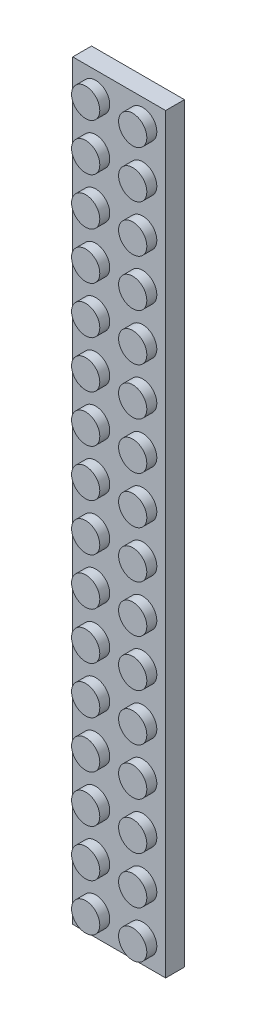
from build123d import *

# Parameters (mm, degrees)
SKETCH_1_W          = 15.8
SKETCH_1_H          = 127.8
EXTRUDE_1_DEPTH     = 3.2
SKETCH_2_R          = 2.4
EXTRUDE_2_DEPTH     = 1.7
SKETCH_3_R          = 2.5
CUT_EXTRUDE_1_DEPTH = 1.8


with BuildPart() as part:
    # Эскиз1 → Бобышка-Вытянуть1 (new body)
    with BuildSketch(Plane.XY):
        Rectangle(SKETCH_1_W, SKETCH_1_H)
    extrude(amount=EXTRUDE_1_DEPTH)

    # Эскиз2 → Бобышка-Вытянуть2 (add)
    with BuildSketch(Plane.XY.offset(3.2)):
        with Locations(Location((-4, 60, 0), (0, 0, 180))):
            Circle(SKETCH_2_R)
        with Locations(Location((4, 60, 0), (0, 0, 180))):
            Circle(SKETCH_2_R)
        with Locations(Location((4, 52, 0), (0, 0, 180))):
            Circle(SKETCH_2_R)
        with Locations(Location((4, 44, 0), (0, 0, 180))):
            Circle(SKETCH_2_R)
        with Locations(Location((4, 36, 0), (0, 0, 180))):
            Circle(SKETCH_2_R)
        with Locations(Location((4, 28, 0), (0, 0, 180))):
            Circle(SKETCH_2_R)
        with Locations(Location((4, 20, 0), (0, 0, 180))):
            Circle(SKETCH_2_R)
        with Locations(Location((4, 12, 0), (0, 0, 180))):
            Circle(SKETCH_2_R)
        with Locations(Location((4, 4, 0), (0, 0, 180))):
            Circle(SKETCH_2_R)
        with Locations(Location((4, -4, 0), (0, 0, 180))):
            Circle(SKETCH_2_R)
        with Locations(Location((4, -12, 0), (0, 0, 180))):
            Circle(SKETCH_2_R)
        with Locations(Location((4, -20, 0), (0, 0, 180))):
            Circle(SKETCH_2_R)
        with Locations(Location((4, -28, 0), (0, 0, 180))):
            Circle(SKETCH_2_R)
        with Locations(Location((4, -36, 0), (0, 0, 180))):
            Circle(SKETCH_2_R)
        with Locations(Location((4, -44, 0), (0, 0, 180))):
            Circle(SKETCH_2_R)
        with Locations(Location((4, -52, 0), (0, 0, 180))):
            Circle(SKETCH_2_R)
        with Locations(Location((4, -60, 0), (0, 0, 180))):
            Circle(SKETCH_2_R)
        with Locations(Location((-4, 52, 0), (0, 0, 180))):
            Circle(SKETCH_2_R)
        with Locations(Location((-4, 44, 0), (0, 0, 180))):
            Circle(SKETCH_2_R)
        with Locations(Location((-4, 36, 0), (0, 0, 180))):
            Circle(SKETCH_2_R)
        with Locations(Location((-4, 28, 0), (0, 0, 180))):
            Circle(SKETCH_2_R)
        with Locations(Location((-4, 20, 0), (0, 0, 180))):
            Circle(SKETCH_2_R)
        with Locations(Location((-4, 12, 0), (0, 0, 180))):
            Circle(SKETCH_2_R)
        with Locations(Location((-4, 4, 0), (0, 0, 180))):
            Circle(SKETCH_2_R)
        with Locations(Location((-4, -4, 0), (0, 0, 180))):
            Circle(SKETCH_2_R)
        with Locations(Location((-4, -12, 0), (0, 0, 180))):
            Circle(SKETCH_2_R)
        with Locations(Location((-4, -20, 0), (0, 0, 180))):
            Circle(SKETCH_2_R)
        with Locations(Location((-4, -28, 0), (0, 0, 180))):
            Circle(SKETCH_2_R)
        with Locations(Location((-4, -36, 0), (0, 0, 180))):
            Circle(SKETCH_2_R)
        with Locations(Location((-4, -44, 0), (0, 0, 180))):
            Circle(SKETCH_2_R)
        with Locations(Location((-4, -52, 0), (0, 0, 180))):
            Circle(SKETCH_2_R)
        with Locations(Location((-4, -60, 0), (0, 0, 180))):
            Circle(SKETCH_2_R)
    extrude(amount=EXTRUDE_2_DEPTH)

    # Эскиз3 → Вырез-Вытянуть1 (cut)
    with BuildSketch(Plane(origin=(0, 0, 0), x_dir=(-1, 0, 0), z_dir=(0, 0, -1))):
        with Locations((-4, 60)):
            Circle(SKETCH_3_R)
        with Locations((4, 60)):
            Circle(SKETCH_3_R)
        with Locations((4, 52)):
            Circle(SKETCH_3_R)
        with Locations((4, 44)):
            Circle(SKETCH_3_R)
        with Locations((4, 36)):
            Circle(SKETCH_3_R)
        with Locations((4, 28)):
            Circle(SKETCH_3_R)
        with Locations((4, 20)):
            Circle(SKETCH_3_R)
        with Locations((4, 12)):
            Circle(SKETCH_3_R)
        with Locations((4, 4)):
            Circle(SKETCH_3_R)
        with Locations((4, -4)):
            Circle(SKETCH_3_R)
        with Locations((4, -12)):
            Circle(SKETCH_3_R)
        with Locations((4, -20)):
            Circle(SKETCH_3_R)
        with Locations((4, -28)):
            Circle(SKETCH_3_R)
        with Locations((4, -36)):
            Circle(SKETCH_3_R)
        with Locations((4, -44)):
            Circle(SKETCH_3_R)
        with Locations((4, -52)):
            Circle(SKETCH_3_R)
        with Locations((4, -60)):
            Circle(SKETCH_3_R)
        with Locations((-4, 52)):
            Circle(SKETCH_3_R)
        with Locations((-4, 44)):
            Circle(SKETCH_3_R)
        with Locations((-4, 36)):
            Circle(SKETCH_3_R)
        with Locations((-4, 28)):
            Circle(SKETCH_3_R)
        with Locations((-4, 20)):
            Circle(SKETCH_3_R)
        with Locations((-4, 12)):
            Circle(SKETCH_3_R)
        with Locations((-4, 4)):
            Circle(SKETCH_3_R)
        with Locations((-4, -4)):
            Circle(SKETCH_3_R)
        with Locations((-4, -12)):
            Circle(SKETCH_3_R)
        with Locations((-4, -20)):
            Circle(SKETCH_3_R)
        with Locations((-4, -28)):
            Circle(SKETCH_3_R)
        with Locations((-4, -36)):
            Circle(SKETCH_3_R)
        with Locations((-4, -44)):
            Circle(SKETCH_3_R)
        with Locations((-4, -52)):
            Circle(SKETCH_3_R)
        with Locations((-4, -60)):
            Circle(SKETCH_3_R)
    extrude(amount=-CUT_EXTRUDE_1_DEPTH, mode=Mode.SUBTRACT)


solid = part.part
